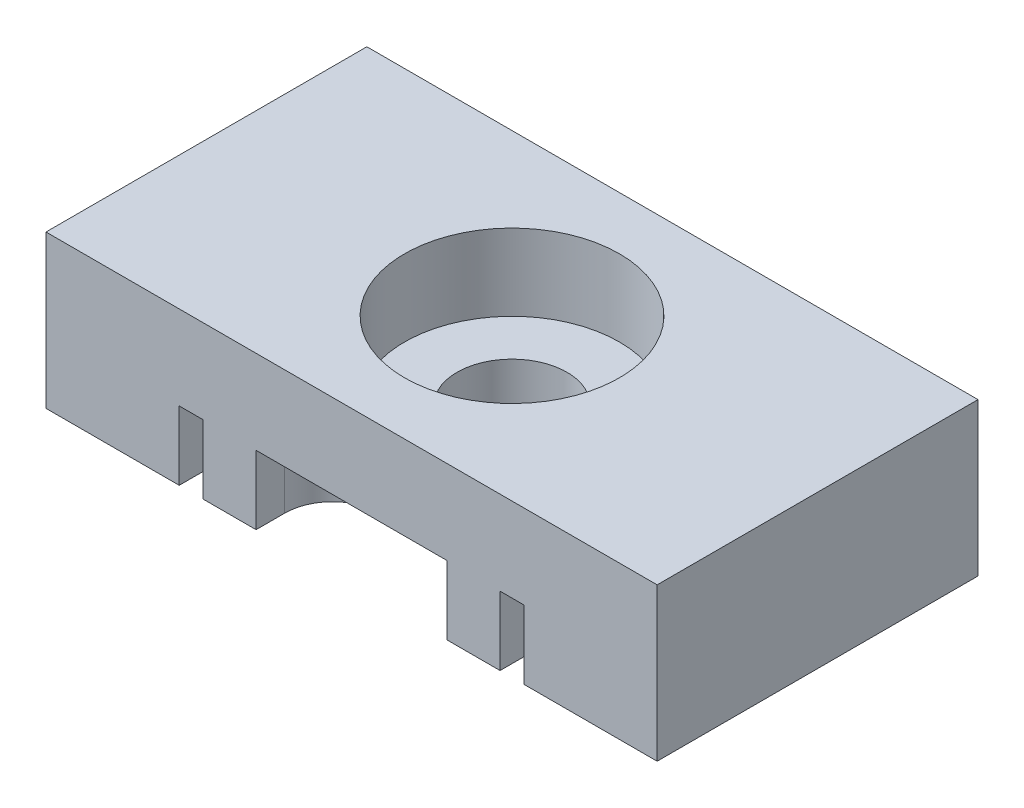
from build123d import *

# Parameters (mm, degrees)
SKETCH1_W               = 20.32
SKETCH1_H               = 10.668
BASE_DEPTH              = 5.08
BOXSLOTS_DEPTH          = 2.286
MOUTINGHOLE_D           = 3.6576
MOUTINGHOLE_CBORE_D     = 7.14502
MOUTINGHOLE_CBORE_DEPTH = 2.54
CUT_EXTRUDE1_DEPTH      = 2.286


with BuildPart() as part:
    # Sketch1 → Base (new body)
    with BuildSketch(Plane(origin=(0, 0, 0), x_dir=(1, 0, 0), z_dir=(0, 1, 0))):
        Rectangle(SKETCH1_W, SKETCH1_H)
    extrude(amount=BASE_DEPTH)

    # Sketch2 → BoxSlots (cut)
    with BuildSketch(Plane.XZ):
        with BuildLine():
            Line((-4.937125, 5.334), (-4.937125, 3.8608))
            ThreePointArc((-4.937125, 3.8608), (-5.334, 3.463925), (-5.730875, 3.8608))
            Line((-5.730875, 3.8608), (-5.730875, 5.334))
            ThreePointArc((-5.730875, 5.334), (-5.334, 5.730875), (-4.937125, 5.334))
        make_face()
        with BuildLine():
            Line((5.730875, 5.334), (5.730875, 3.8608))
            ThreePointArc((5.730875, 3.8608), (5.334, 3.463925), (4.937125, 3.8608))
            Line((4.937125, 3.8608), (4.937125, 5.334))
            ThreePointArc((4.937125, 5.334), (5.334, 5.730875), (5.730875, 5.334))
        make_face()
    extrude(amount=-BOXSLOTS_DEPTH, mode=Mode.SUBTRACT)

    # MoutingHole (through all)
    with Locations(Plane(origin=(0, 5.08, 0), x_dir=(1, 0, 0), z_dir=(0, 1, 0))):
        with Locations((0, 0)):
            CounterBoreHole(MOUTINGHOLE_D / 2, MOUTINGHOLE_CBORE_D / 2, MOUTINGHOLE_CBORE_DEPTH)

    # Sketch7 → Cut-Extrude1 (cut)
    with BuildSketch(Plane.XZ):
        with BuildLine():
            Line((-3.175, 5.334), (3.175, 5.334))
            Line((3.175, 5.334), (3.175, 4.3815))
            ThreePointArc((3.175, 4.3815), (2.710032015, 3.258967985), (1.5875, 2.794))
            Line((1.5875, 2.794), (-1.5875, 2.794))
            ThreePointArc((-1.5875, 2.794), (-2.710032015, 3.258967985), (-3.175, 4.3815))
            Line((-3.175, 4.3815), (-3.175, 5.334))
        make_face()
    extrude(amount=-CUT_EXTRUDE1_DEPTH, mode=Mode.SUBTRACT)


solid = part.part
